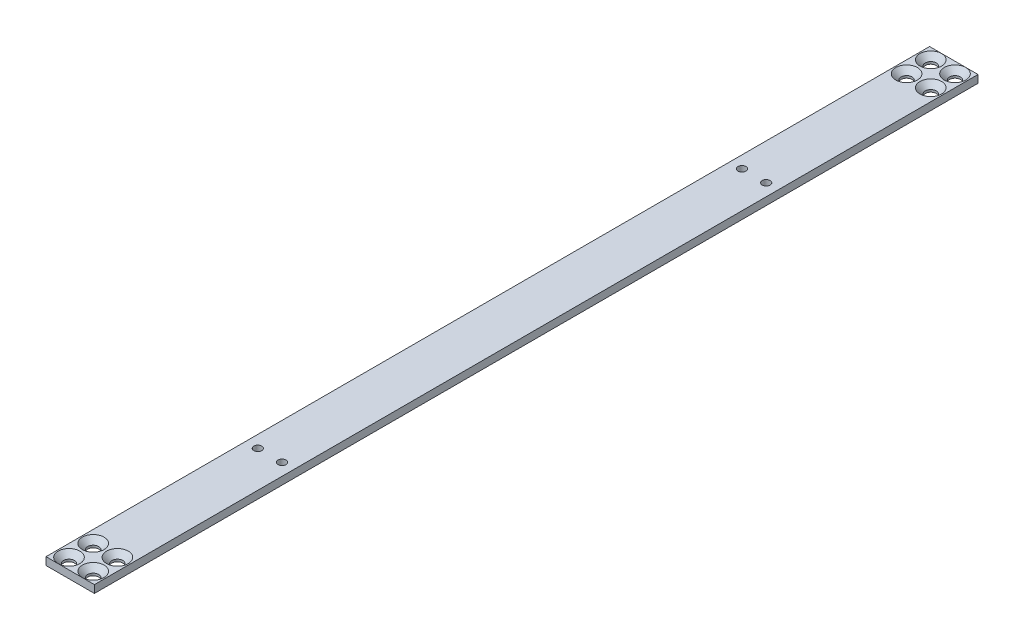
from build123d import *

# Parameters (mm, degrees)
SKETCH1_W                    = 20
SKETCH1_H                    = 365
BOSS_EXTRUDE1_DEPTH          = 3.175
CSK_FOR_M4_SFHCS1_AT_2_COUNT = 2
CSK_FOR_M4_SFHCS1_AT_2_PITCH = 14.142135624
CSK_FOR_M4_SFHCS1_AT_3_COUNT = 2
CSK_FOR_M4_SFHCS1_AT_3_PITCH = 10
CSK_FOR_M4_SFHCS1_AT_4_COUNT = 2
CSK_FOR_M4_SFHCS1_AT_4_PITCH = 10
CSK_FOR_M4_SFHCS1_AT_5_COUNT = 2
CSK_FOR_M4_SFHCS1_AT_5_PITCH = 346
CSK_FOR_M4_SFHCS1_AT_6_COUNT = 2
CSK_FOR_M4_SFHCS1_AT_6_PITCH = 336.148776586
CSK_FOR_M4_SFHCS1_AT_7_COUNT = 2
CSK_FOR_M4_SFHCS1_AT_7_PITCH = 346.144478506
CSK_FOR_M4_SFHCS1_AT_8_COUNT = 2
CSK_FOR_M4_SFHCS1_AT_8_PITCH = 336
M4X0_7_TAPPED_HOLE1_D        = 3.3


with BuildPart() as part:
    # Sketch1 → Boss-Extrude1 (new body)
    with BuildSketch(Plane(origin=(0, 0, 0), x_dir=(1, 0, 0), z_dir=(0, 1, 0))):
        Rectangle(SKETCH1_W, SKETCH1_H)
    extrude(amount=BOSS_EXTRUDE1_DEPTH)

    # Sketch3 → CSK for M4 SFHCS1 (revolve, cut)
    with BuildSketch(Plane(origin=(5, 3.175, 168), x_dir=(0, 0, 1), z_dir=(1, 0, 0))):
        Polygon((0, 0), (0, 3.175), (2.25, 3.175), (2.25, 2.23), (4.48, 0), align=None)
    csk_for_m4_sfhcs1 = revolve(axis=Axis((5, 9.525, 168), (0, -1, 0)), mode=Mode.SUBTRACT)

    # CSK for M4 SFHCS1 at 2: CSK for M4 SFHCS1 ×2
    with Locations(*[Vector(-0.7071067811865469, 0, 0.7071067811865482) * (i * CSK_FOR_M4_SFHCS1_AT_2_PITCH) for i in range(1, CSK_FOR_M4_SFHCS1_AT_2_COUNT)]):
        add(csk_for_m4_sfhcs1, mode=Mode.SUBTRACT)

    # CSK for M4 SFHCS1 at 3: CSK for M4 SFHCS1 ×2
    with Locations(*[(-i * CSK_FOR_M4_SFHCS1_AT_3_PITCH, 0, 0) for i in range(1, CSK_FOR_M4_SFHCS1_AT_3_COUNT)]):
        add(csk_for_m4_sfhcs1, mode=Mode.SUBTRACT)

    # CSK for M4 SFHCS1 at 4: CSK for M4 SFHCS1 ×2
    with Locations(*[(0, 0, i * CSK_FOR_M4_SFHCS1_AT_4_PITCH) for i in range(1, CSK_FOR_M4_SFHCS1_AT_4_COUNT)]):
        add(csk_for_m4_sfhcs1, mode=Mode.SUBTRACT)

    # CSK for M4 SFHCS1 at 5: CSK for M4 SFHCS1 ×2
    with Locations(*[(0, 0, -i * CSK_FOR_M4_SFHCS1_AT_5_PITCH) for i in range(1, CSK_FOR_M4_SFHCS1_AT_5_COUNT)]):
        add(csk_for_m4_sfhcs1, mode=Mode.SUBTRACT)

    # CSK for M4 SFHCS1 at 6: CSK for M4 SFHCS1 ×2
    with Locations(*[Vector(-0.029748732396333223, 0, -0.9995574085167952) * (i * CSK_FOR_M4_SFHCS1_AT_6_PITCH) for i in range(1, CSK_FOR_M4_SFHCS1_AT_6_COUNT)]):
        add(csk_for_m4_sfhcs1, mode=Mode.SUBTRACT)

    # CSK for M4 SFHCS1 at 7: CSK for M4 SFHCS1 ×2
    with Locations(*[Vector(-0.028889670703889703, 0, -0.9995826063545828) * (i * CSK_FOR_M4_SFHCS1_AT_7_PITCH) for i in range(1, CSK_FOR_M4_SFHCS1_AT_7_COUNT)]):
        add(csk_for_m4_sfhcs1, mode=Mode.SUBTRACT)

    # CSK for M4 SFHCS1 at 8: CSK for M4 SFHCS1 ×2
    with Locations(*[(0, 0, -i * CSK_FOR_M4_SFHCS1_AT_8_PITCH) for i in range(1, CSK_FOR_M4_SFHCS1_AT_8_COUNT)]):
        add(csk_for_m4_sfhcs1, mode=Mode.SUBTRACT)

    # M4x0.7 Tapped Hole1 (through all)
    with Locations(Plane(origin=(0, 3.175, 0), x_dir=(1, 0, 0), z_dir=(0, 1, 0))):
        with Locations((-5, -100), (-5, 100), (5, 100), (5, -100)):
            Hole(M4X0_7_TAPPED_HOLE1_D / 2)


solid = part.part
